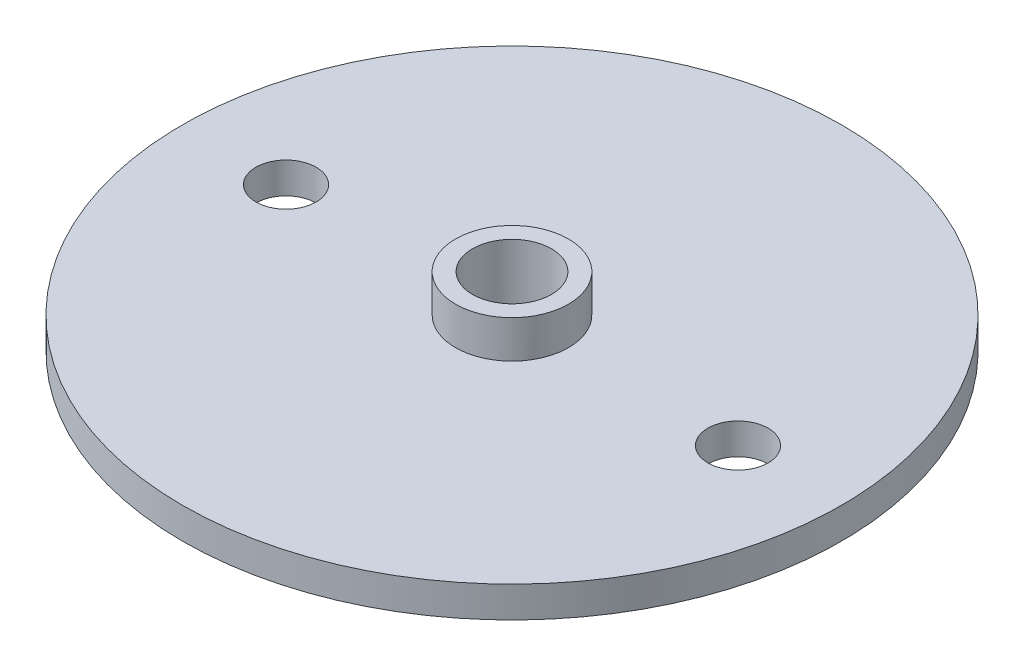
from build123d import *

# Parameters (mm, degrees)
SKETCH_1_R           = 3
SKETCH_1_R_2         = 2.1
EXTRUDE_1_DEPTH      = 3
EXTRUDE_2_DEPTH      = 0.65
EXTRUDE_2_DEPTH_BACK = 1
SKETCH_2_R           = 17.5
SKETCH_2_R_2         = 2.1
SKETCH_3_R           = 1.6
CUT_EXTRUDE_1_DEPTH  = 25.829418036


with BuildPart() as part:
    # ｽｹｯﾁ1 → ﾎﾞｽ - 押し出し1 (new body)
    with BuildSketch(Plane(origin=(0, 0, 0), x_dir=(1, 0, 0), z_dir=(0, 1, 0))):
        with Locations(Location((0, 0, 0), (0, 0, 270))):
            Circle(SKETCH_1_R)
        with Locations(Location((0, 0, 0), (0, 0, 270))):
            Circle(SKETCH_1_R_2, mode=Mode.SUBTRACT)
    extrude(amount=EXTRUDE_1_DEPTH)

    # ｽｹｯﾁ2 → ﾎﾞｽ - 押し出し2 (add, two sides: drawn at the far end of the back side and taken through both)
    with BuildSketch(Plane.XZ.offset(-EXTRUDE_2_DEPTH_BACK)):
        with Locations(Location((0, 0, 0), (0, 0, 270))):
            Circle(SKETCH_2_R)
        with Locations(Location((0, 0, 0), (0, 0, 270))):
            Circle(SKETCH_2_R_2, mode=Mode.SUBTRACT)
    extrude(amount=EXTRUDE_2_DEPTH + EXTRUDE_2_DEPTH_BACK)

    # ｽｹｯﾁ3 → ｶｯﾄ - 押し出し1 (cut, through all)
    with BuildSketch(Plane(origin=(0, 1, 0), x_dir=(1, 0, 0), z_dir=(0, 1, 0))):
        with Locations(Location((-12, 0, 0), (0, 0, 270))):
            Circle(SKETCH_3_R)
        with Locations(Location((12, 0, 0), (0, 0, 90))):
            Circle(SKETCH_3_R)
    extrude(amount=-CUT_EXTRUDE_1_DEPTH, mode=Mode.SUBTRACT)


solid = part.part
